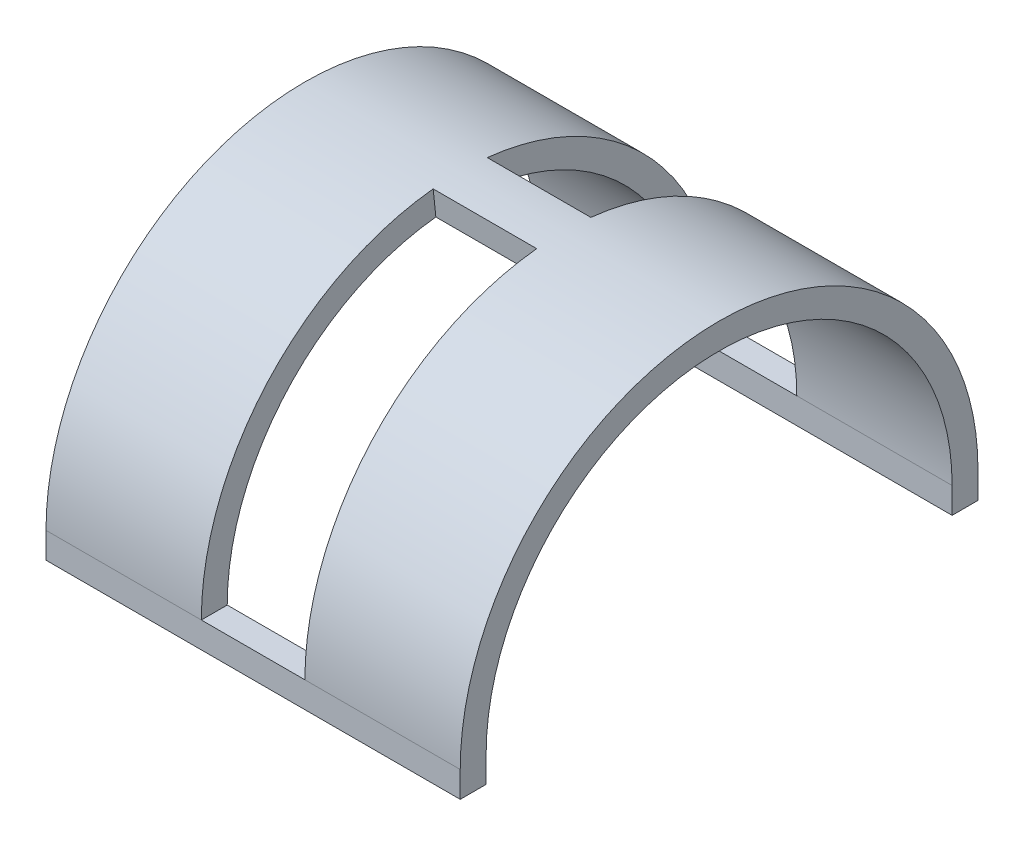
from build123d import *

# Parameters (mm, degrees)
BOSS_EXTRUDE3_DEPTH = 30
BOSS_EXTRUDE4_DEPTH = 10
SKETCH4_W           = 80
SKETCH4_H           = 5
BOSS_EXTRUDE5_DEPTH = 5


with BuildPart() as part:
    # Sketch1 → Boss-Extrude3 (new body)
    with BuildSketch(Plane(origin=(0, 0, 0), x_dir=(0, 0, -1), z_dir=(1, 0, 0))):
        with BuildLine():
            Line((-50, 0), (-45, 0))
            ThreePointArc((-45, 0), (0, 45), (45, 0))
            Line((45, 0), (50, 0))
            ThreePointArc((50, 0), (0, 50), (-50, 0))
        make_face()
    extrude(amount=BOSS_EXTRUDE3_DEPTH)

    # Sketch3 → Boss-Extrude4 (add)
    with BuildSketch(Plane(origin=(30, 0, 0), x_dir=(0, 0, -1), z_dir=(1, 0, 0))):
        with BuildLine():
            Line((-5.226423163, 49.726094768), (-4.703780847, 44.753485292))
            ThreePointArc((-4.703780847, 44.753485292), (-2.355118031, 44.938329064), (0, 45))
            Line((0, 45), (0, 50))
            ThreePointArc((0, 50), (-2.616797812, 49.931476738), (-5.226423163, 49.726094768))
        make_face()
        with BuildLine():
            ThreePointArc((0, 45), (2.355118031, 44.938329064), (4.703780847, 44.753485292))
            Line((4.703780847, 44.753485292), (5.226423163, 49.726094768))
            ThreePointArc((5.226423163, 49.726094768), (2.616797812, 49.931476738), (0, 50))
            Line((0, 50), (0, 45))
        make_face()
    extrude(amount=BOSS_EXTRUDE4_DEPTH)

    # Mirror3: part across plane


with BuildPart() as part_1:
    add(part.part)
    add(part.part.mirror(Plane(origin=(40, 0, 0), x_dir=(0, 0, 1), z_dir=(1, 0, 0))))

    # Sketch4 → Boss-Extrude5 (add)
    with BuildSketch(Plane.XZ):
        with Locations((40, 47.5)):
            Rectangle(SKETCH4_W, SKETCH4_H)
        with Locations((40, -47.5)):
            Rectangle(SKETCH4_W, SKETCH4_H)
    extrude(amount=BOSS_EXTRUDE5_DEPTH)


solid = part_1.part
